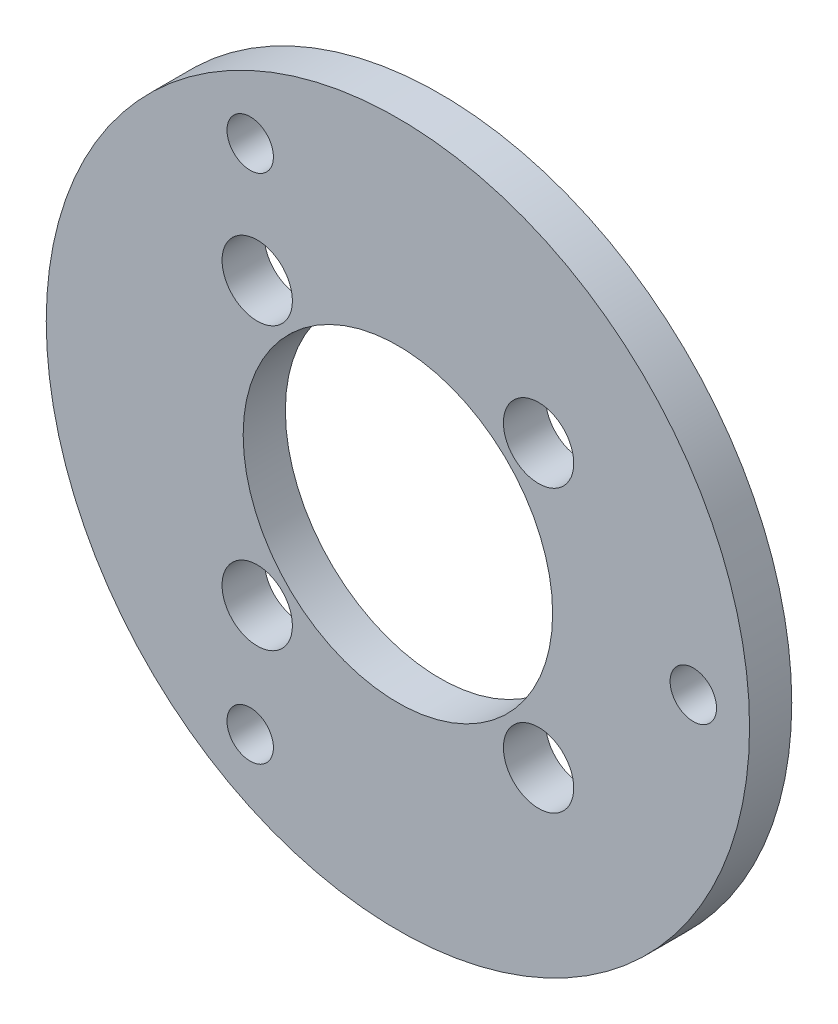
from build123d import *

# Parameters (mm, degrees)
SKETCH_1_R      = 25
SKETCH_1_R_2    = 11
SKETCH_1_R_3    = 2.5
SKETCH_1_R_4    = 1.65
EXTRUDE_1_DEPTH = 3


with BuildPart() as part:
    # 草图1 → 凸台-拉伸1 (new body)
    with BuildSketch(Plane.XY):
        Circle(SKETCH_1_R)
        Circle(SKETCH_1_R_2, mode=Mode.SUBTRACT)
        with Locations((10, 10)):
            Circle(SKETCH_1_R_3, mode=Mode.SUBTRACT)
        with Locations((-10, 10)):
            Circle(SKETCH_1_R_3, mode=Mode.SUBTRACT)
        with Locations((10, -10)):
            Circle(SKETCH_1_R_3, mode=Mode.SUBTRACT)
        with Locations((-10, -10)):
            Circle(SKETCH_1_R_3, mode=Mode.SUBTRACT)
        with Locations((21, 0)):
            Circle(SKETCH_1_R_4, mode=Mode.SUBTRACT)
        with Locations((-10.5, 18.186533479)):
            Circle(SKETCH_1_R_4, mode=Mode.SUBTRACT)
        with Locations((-10.5, -18.186533479)):
            Circle(SKETCH_1_R_4, mode=Mode.SUBTRACT)
    extrude(amount=EXTRUDE_1_DEPTH)


solid = part.part
